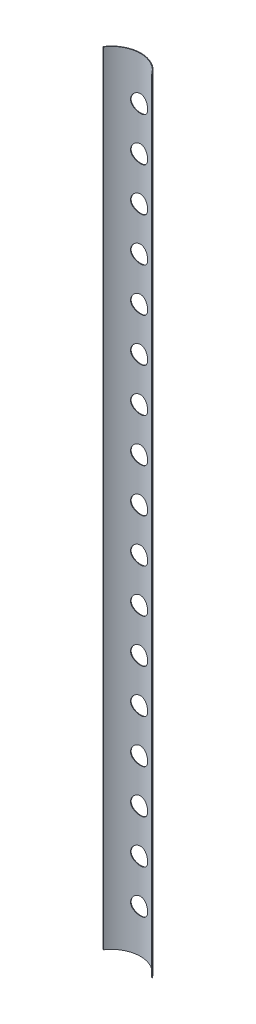
from build123d import *

# Parameters (mm, degrees)
BOSS_EXTRUDE1_DEPTH = 457.2
SKETCH4_R           = 5
CUT_EXTRUDE2_DEPTH  = 25.4
LPATTERN1_COUNT     = 17
LPATTERN1_PITCH     = 25.4


with BuildPart() as part:
    # Sketch2 → Boss-Extrude1 (new body)
    with BuildSketch(Plane(origin=(0, 0, 0), x_dir=(1, 0, 0), z_dir=(0, 1, 0))):
        with BuildLine():
            Line((-18.391681054, -0.131319119), (-18.021681054, -0.131319119))
            ThreePointArc((-18.021681054, -0.131319119), (-3.972183239, 7.366467371), (10.077314576, -0.131319119))
            Line((10.077314576, -0.131319119), (10.498318946, -0.131319119))
            ThreePointArc((10.498318946, -0.131319119), (-3.946681054, 7.688680881), (-18.391681054, -0.131319119))
        make_face()
    extrude(amount=BOSS_EXTRUDE1_DEPTH)

    # Sketch4 → Cut-Extrude2 (cut)
    with BuildSketch(Plane.XY.offset(0.131319119)):
        with Locations((-3.946681054, 25.4)):
            Circle(SKETCH4_R)
    cut_extrude2 = extrude(amount=-CUT_EXTRUDE2_DEPTH, mode=Mode.SUBTRACT)

    # LPattern1: Cut-Extrude2 ×17
    with Locations(*[(0, i * LPATTERN1_PITCH, 0) for i in range(1, LPATTERN1_COUNT)]):
        add(cut_extrude2, mode=Mode.SUBTRACT)


solid = part.part
